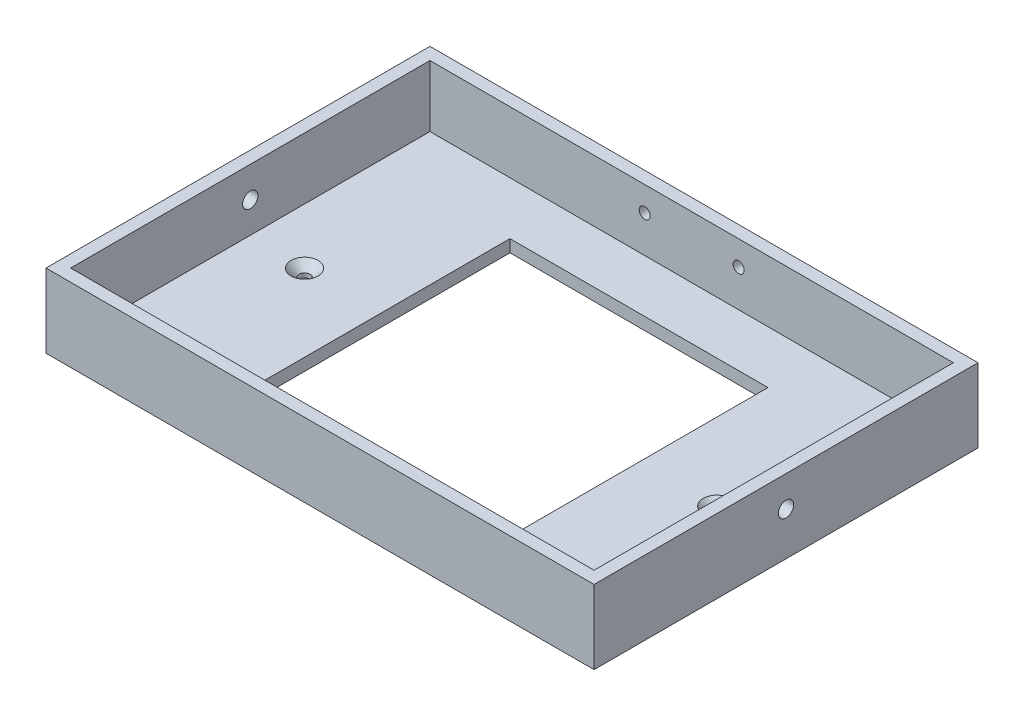
from build123d import *

# Parameters (mm, degrees)
SKETCH1_W                                       = 89.09
SKETCH1_H                                       = 62.42
BOSS_EXTRUDE1_DEPTH                             = 2
SKETCH1_3_W                                     = 89.09
SKETCH1_3_H                                     = 62.42
SKETCH1_3_W_2                                   = 85.09
SKETCH1_3_H_2                                   = 58.42
BOSS_EXTRUDE2_DEPTH                             = 10
CSK_FOR_M2_FLAT_HEAD_MACHINE_SCREW1_D           = 1.8
CSK_FOR_M2_FLAT_HEAD_MACHINE_SCREW1_DEPTH       = 9.906
CSK_FOR_M2_FLAT_HEAD_MACHINE_SCREW1_CSINK_D     = 4.4
CSK_FOR_M2_FLAT_HEAD_MACHINE_SCREW1_CSINK_ANGLE = 90
CSK_FOR_M2_FLAT_HEAD_MACHINE_SCREW1_TIP         = 0.540774557
SKETCH7_W                                       = 41.935160688
SKETCH7_H                                       = 41.279429724
CUT_EXTRUDE1_DEPTH                              = 2.54
CUT_EXTRUDE2_REACH                              = 79.334
SKETCH8_R                                       = 0.9
SKETCH9_R                                       = 1.25
CUT_EXTRUDE3_DEPTH                              = 95.92677283


with BuildPart() as part:
    # Sketch1 → Boss-Extrude1 (new body)
    with BuildSketch(Plane(origin=(0, 0, 0), x_dir=(1, 0, 0), z_dir=(0, 1, 0))):
        Rectangle(SKETCH1_W, SKETCH1_H)
    extrude(amount=-BOSS_EXTRUDE1_DEPTH)

    # Sketch1<3> → Boss-Extrude2 (add)
    with BuildSketch(Plane(origin=(0, 0, 0), x_dir=(1, 0, 0), z_dir=(0, 1, 0))):
        Rectangle(SKETCH1_3_W, SKETCH1_3_H)
        Rectangle(SKETCH1_3_W_2, SKETCH1_3_H_2, mode=Mode.SUBTRACT)
    extrude(amount=BOSS_EXTRUDE2_DEPTH)

    # CSK for M2 Flat Head Machine Screw1
    with Locations(Plane(origin=(0, 0, 0), x_dir=(1, 0, 0), z_dir=(0, 1, 0))):
        with Locations((-33.5, -0.21892606), (33.5, -0.21892606)):
            CounterSinkHole(CSK_FOR_M2_FLAT_HEAD_MACHINE_SCREW1_D / 2, CSK_FOR_M2_FLAT_HEAD_MACHINE_SCREW1_CSINK_D / 2, depth=CSK_FOR_M2_FLAT_HEAD_MACHINE_SCREW1_DEPTH, counter_sink_angle=CSK_FOR_M2_FLAT_HEAD_MACHINE_SCREW1_CSINK_ANGLE)
            with Locations((0, 0, -(CSK_FOR_M2_FLAT_HEAD_MACHINE_SCREW1_DEPTH + CSK_FOR_M2_FLAT_HEAD_MACHINE_SCREW1_TIP / 2))):  # 118° drill point
                Cone(0, CSK_FOR_M2_FLAT_HEAD_MACHINE_SCREW1_D / 2, CSK_FOR_M2_FLAT_HEAD_MACHINE_SCREW1_TIP, mode=Mode.SUBTRACT)

    # Sketch7 → Cut-Extrude1 (cut)
    with BuildSketch(Plane(origin=(0, 0, 0), x_dir=(1, 0, 0), z_dir=(0, 1, 0))):
        Rectangle(SKETCH7_W, SKETCH7_H)
    extrude(amount=-CUT_EXTRUDE1_DEPTH, mode=Mode.SUBTRACT)

    # Sketch8 → Cut-Extrude2 (cut, up to next)
    with BuildSketch(Plane(origin=(0, 0, -31.21), x_dir=(-1, 0, 0), z_dir=(0, 0, -1)), mode=Mode.PRIVATE) as cut_extrude2_sk1:
        with Locations((-7.635, 6)):
            Circle(SKETCH8_R)
    cut_extrude2_tool1 = extrude(cut_extrude2_sk1.sketch, amount=-CUT_EXTRUDE2_REACH, mode=Mode.PRIVATE) & part.part
    # Sketch8 → Cut-Extrude2 (cut, up to next)
    with BuildSketch(Plane(origin=(0, 0, -31.21), x_dir=(-1, 0, 0), z_dir=(0, 0, -1)), mode=Mode.PRIVATE) as cut_extrude2_sk2:
        with Locations((7.635, 6)):
            Circle(SKETCH8_R)
    cut_extrude2_tool2 = extrude(cut_extrude2_sk2.sketch, amount=-CUT_EXTRUDE2_REACH, mode=Mode.PRIVATE) & part.part
    add(cut_extrude2_tool1.solids().sort_by_distance((7.635, 6, -31.21))[0], mode=Mode.SUBTRACT)
    add(cut_extrude2_tool2.solids().sort_by_distance((-7.635, 6, -31.21))[0], mode=Mode.SUBTRACT)

    # Sketch9 → Cut-Extrude3 (cut, through all)
    with BuildSketch(Plane(origin=(44.545, 0, 0), x_dir=(0, 0, -1), z_dir=(1, 0, 0))):
        with Locations((0, 5)):
            Circle(SKETCH9_R)
    extrude(amount=-CUT_EXTRUDE3_DEPTH, mode=Mode.SUBTRACT)


solid = part.part
